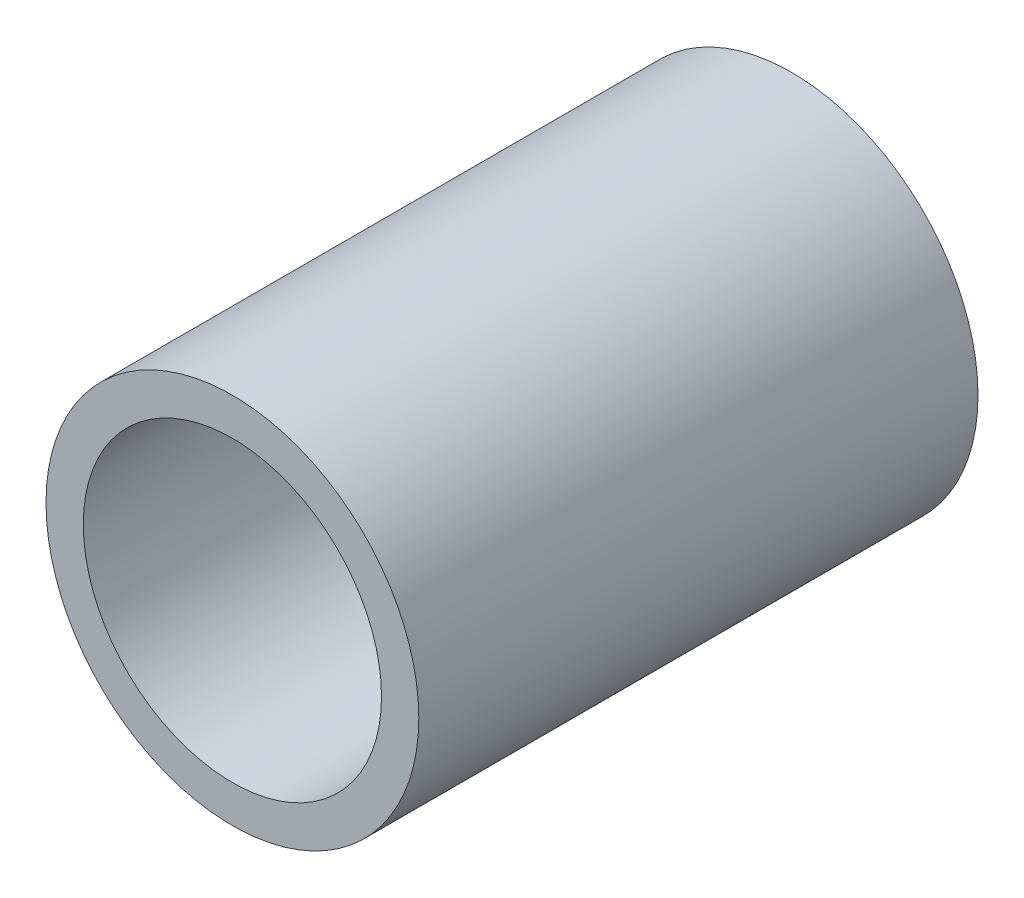
from build123d import *

# Parameters (mm, degrees)
ESQUISSE1_R        = 5
ESQUISSE1_R_2      = 4
BOSS_EXTRU_1_DEPTH = 15


with BuildPart() as part:
    # Esquisse1 → Boss.-Extru.1 (new body)
    with BuildSketch(Plane(origin=(0, 0, 0), x_dir=(0, 1, 0), z_dir=(0, 0, 1))):
        with Locations(Location((0, 0, 0), (0, 0, 270))):
            Circle(ESQUISSE1_R)
        with Locations(Location((0, 0, 0), (0, 0, 270))):
            Circle(ESQUISSE1_R_2, mode=Mode.SUBTRACT)
    extrude(amount=BOSS_EXTRU_1_DEPTH)


solid = part.part
